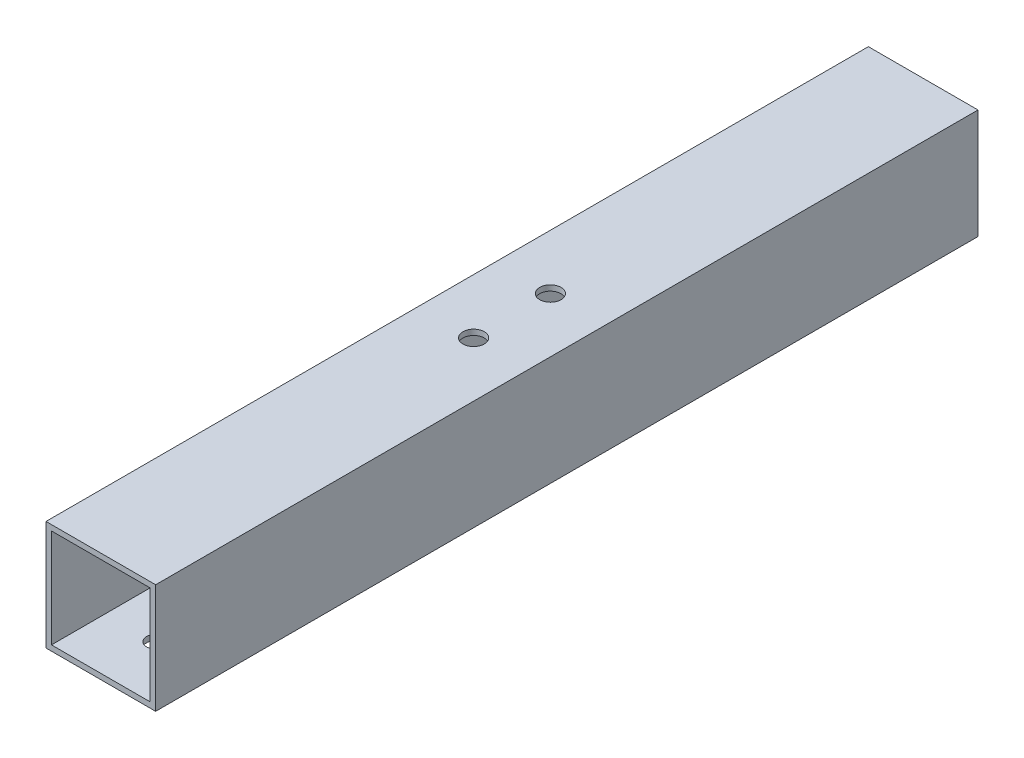
from build123d import *

# Parameters (mm, degrees)
SKETCH_1_W          = 20
SKETCH_1_H          = 20
SKETCH_1_W_2        = 18
SKETCH_1_H_2        = 18
EXTRUDE_1_DEPTH     = 150
SKETCH_3_R          = 1.95
CUT_EXTRUDE_2_DEPTH = 153.643375225
CUT_EXTRUDE_3_REACH = 154.643
SKETCH_4_R          = 1.65


with BuildPart() as part:
    # 草图1 → 拉伸-薄壁1 (new body)
    with BuildSketch(Plane.XY):
        with Locations((10, -10)):
            Rectangle(SKETCH_1_W, SKETCH_1_H)
        with Locations((10, -10)):
            Rectangle(SKETCH_1_W_2, SKETCH_1_H_2, mode=Mode.SUBTRACT)
    extrude(amount=EXTRUDE_1_DEPTH)

    # 草图3 → 切除-拉伸2 (cut, through all)
    with BuildSketch(Plane.XZ.offset(20)):
        with Locations(Location((10, 82, 0), (0, 0, 270))):
            Circle(SKETCH_3_R)
        with Locations(Location((10, 68, 0), (0, 0, 270))):
            Circle(SKETCH_3_R)
    extrude(amount=-CUT_EXTRUDE_2_DEPTH, mode=Mode.SUBTRACT)

    # 草图4 → 切除-拉伸3 (cut, up to next)
    with BuildSketch(Plane.XZ.offset(20), mode=Mode.PRIVATE) as cut_extrude_3_sk1:
        with Locations(Location((10, 140, 0), (0, 0, 270))):
            Circle(SKETCH_4_R)
    cut_extrude_3_tool1 = extrude(cut_extrude_3_sk1.sketch, amount=-CUT_EXTRUDE_3_REACH, mode=Mode.PRIVATE) & part.part
    # 草图4 → 切除-拉伸3 (cut, up to next)
    with BuildSketch(Plane.XZ.offset(20), mode=Mode.PRIVATE) as cut_extrude_3_sk2:
        with Locations(Location((10, 10, 0), (0, 0, 270))):
            Circle(SKETCH_4_R)
    cut_extrude_3_tool2 = extrude(cut_extrude_3_sk2.sketch, amount=-CUT_EXTRUDE_3_REACH, mode=Mode.PRIVATE) & part.part
    add(cut_extrude_3_tool1.solids().sort_by_distance((10, -20, 140))[0], mode=Mode.SUBTRACT)
    add(cut_extrude_3_tool2.solids().sort_by_distance((10, -20, 10))[0], mode=Mode.SUBTRACT)


solid = part.part
